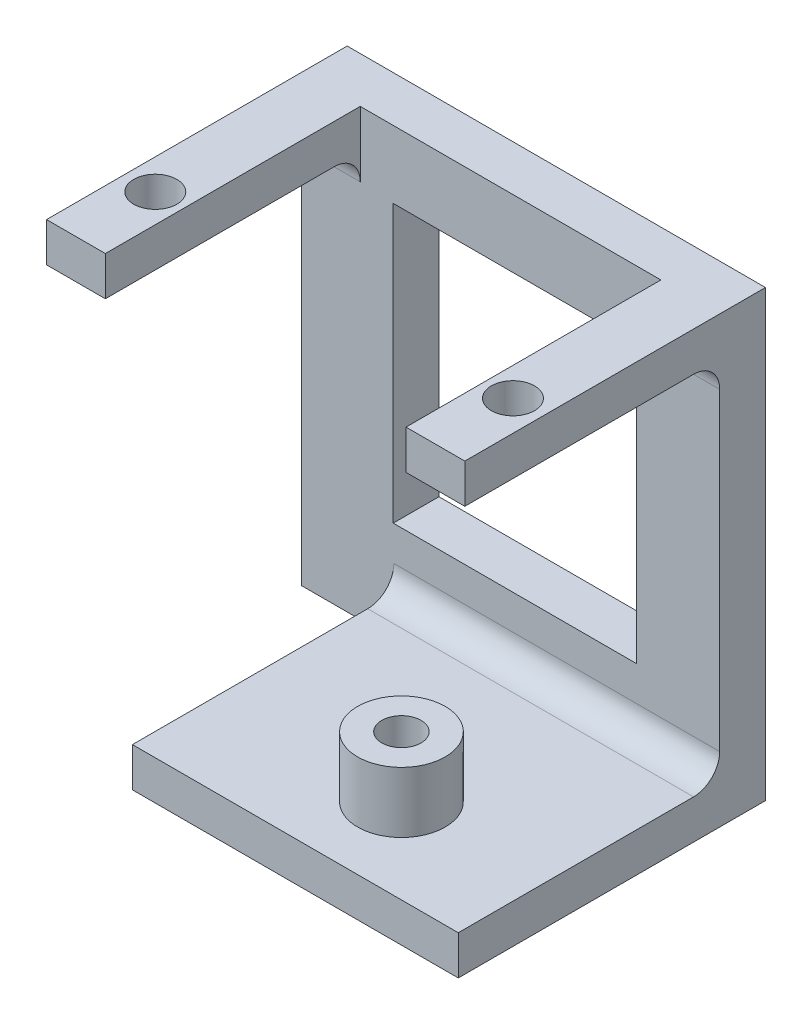
from build123d import *

# Parameters (mm, degrees)
SKETCH_1_W               = 4.5
SKETCH_1_H               = 23
EXTRUDE_1_DEPTH          = 1.5
EXTRUDE_1_2_DEPTH        = 1.5
CUT_EXTRUDE_1_DEPTH      = 24.393375131
CUT_EXTRUDE_1_DEPTH_BACK = 24.393375131
SKETCH_2_R               = 1.65
SKETCH_4_W               = 3.5
SKETCH_4_H               = 3
EXTRUDE_3_DEPTH          = 23
SKETCH_5_W               = 32
SKETCH_5_H               = 3.5
EXTRUDE_4_DEPTH          = 31
SKETCH_6_W               = 32
SKETCH_6_H               = 3
EXTRUDE_5_DEPTH          = 20
SKETCH_8_R               = 3.35
EXTRUDE_6_DEPTH          = 6
CUT_EXTRUDE_2_REACH      = 36.205
SKETCH_9_R               = 1.5
SKETCH_10_W              = 18.606711353
SKETCH_10_H              = 21.185184653
CUT_EXTRUDE_3_DEPTH      = 44.179856415
SKETCH_11_W              = 7.069778579
SKETCH_11_H              = 20
CUT_EXTRUDE_4_DEPTH      = 10
FILLET_1_R               = 2


with BuildPart() as part:
    # 草图1 → 凸台-拉伸1 (new, symmetric)
    with BuildSketch(Plane(origin=(0, 0, 0), x_dir=(1, 0, 0), z_dir=(0, 1, 0))):
        with Locations((-13.75, 5.5)):
            Rectangle(SKETCH_1_W, SKETCH_1_H)
    extrude(amount=EXTRUDE_1_DEPTH, both=True)


with BuildPart() as body_2:
    # 草图1 → Extrude 1 2 (new, symmetric)
    with BuildSketch(Plane(origin=(0, 0, 0), x_dir=(1, 0, 0), z_dir=(0, 1, 0))):
        with Locations((13.75, 5.5)):
            Rectangle(SKETCH_1_W, SKETCH_1_H)
    extrude(amount=EXTRUDE_1_2_DEPTH, both=True)


with BuildPart() as cut_extrude_1_tool:
    # 草图2 → 切除-拉伸1 (new, two sides: drawn at the far end of the back side and taken through both)
    with BuildSketch(Plane(origin=(0, 0, 0), x_dir=(1, 0, 0), z_dir=(0, 1, 0)).offset(-CUT_EXTRUDE_1_DEPTH_BACK)):
        with Locations(Location((-13.68, 0, 0), (0, 0, 270))):
            Circle(SKETCH_2_R)
        with Locations(Location((13.68, 0, 0), (0, 0, 270))):
            Circle(SKETCH_2_R)
    extrude(amount=CUT_EXTRUDE_1_DEPTH + CUT_EXTRUDE_1_DEPTH_BACK)


with BuildPart() as part_1:
    add(part.part)

    # 切除-拉伸1: cut by cut_extrude_1_tool
    add(cut_extrude_1_tool.part, mode=Mode.SUBTRACT)



with BuildPart() as body_2_1:
    add(body_2.part)

    # 切除-拉伸1: cut by cut_extrude_1_tool
    add(cut_extrude_1_tool.part, mode=Mode.SUBTRACT)


with BuildPart() as body_3:
    # 草图4 → 凸台-拉伸3 (new body)
    with BuildSketch(Plane(origin=(-11.5, 0, 0), x_dir=(0, 0, -1), z_dir=(1, 0, 0))):
        with Locations((15.25, 0)):
            Rectangle(SKETCH_4_W, SKETCH_4_H)
    extrude(amount=EXTRUDE_3_DEPTH)


with BuildPart() as part_2:
    add(part_1.part)

    add(body_2_1.part)  # 凸台-拉伸4 merges body 2

    add(body_3.part)  # 凸台-拉伸4 merges body 3
    # 草图5 → 凸台-拉伸4 (add)
    with BuildSketch(Plane(origin=(0, -1.5, 0), x_dir=(-1, 0, 0), z_dir=(0, -1, 0))):
        with Locations((0, 15.25)):
            Rectangle(SKETCH_5_W, SKETCH_5_H)
    extrude(amount=EXTRUDE_4_DEPTH)

    # 草图6 → 凸台-拉伸5 (add)
    with BuildSketch(Plane.XY.offset(-13.5)):
        with Locations((0, -31)):
            Rectangle(SKETCH_6_W, SKETCH_6_H)
    extrude(amount=EXTRUDE_5_DEPTH)

    # 草图8 → 凸台-拉伸6 (add)
    with BuildSketch(Plane(origin=(0, -29.5, 0), x_dir=(1, 0, 0), z_dir=(0, 1, 0))):
        with Locations(Location((5.15, 0, 0), (0, 0, 90))):
            Circle(SKETCH_8_R)
    extrude(amount=EXTRUDE_6_DEPTH)

    # 草图9 → 切除-拉伸2 (cut, up to next)
    with BuildSketch(Plane(origin=(0, -23.5, 0), x_dir=(1, 0, 0), z_dir=(0, 1, 0)), mode=Mode.PRIVATE) as cut_extrude_2_sk1:
        with Locations(Location((5.15, 0, 0), (0, 0, 270))):
            Circle(SKETCH_9_R)
    cut_extrude_2_tool1 = extrude(cut_extrude_2_sk1.sketch, amount=-CUT_EXTRUDE_2_REACH, mode=Mode.PRIVATE) & part_2.part
    add(cut_extrude_2_tool1.solids().sort_by_distance((5.15, -23.5, 0))[0], mode=Mode.SUBTRACT)

    # 草图10 → 切除-拉伸3 (cut, through all)
    with BuildSketch(Plane(origin=(0, 0, -17), x_dir=(-1, 0, 0), z_dir=(0, 0, -1))):
        with Locations((-0.324302099, -14.259789027)):
            Rectangle(SKETCH_10_W, SKETCH_10_H)
    extrude(amount=-CUT_EXTRUDE_3_DEPTH, mode=Mode.SUBTRACT)

    # 草图11 → 切除-拉伸4 (cut)
    with BuildSketch(Plane(origin=(0, -29.5, 0), x_dir=(1, 0, 0), z_dir=(0, 1, 0))):
        with Locations((-12.46511071, 3.5)):
            Rectangle(SKETCH_11_W, SKETCH_11_H)
    extrude(amount=-CUT_EXTRUDE_4_DEPTH, mode=Mode.SUBTRACT)

    # 圆角1
    fillet_1_edges = [part_2.edges().sort_by_distance(p)[0] for p in [
        (-13.75, -1.5, -13.5),
        (13.75, -1.5, -13.5),
        (3.534889289, -29.5, -13.5),
    ]]
    fillet(fillet_1_edges, radius=FILLET_1_R)


solid = part_2.part
